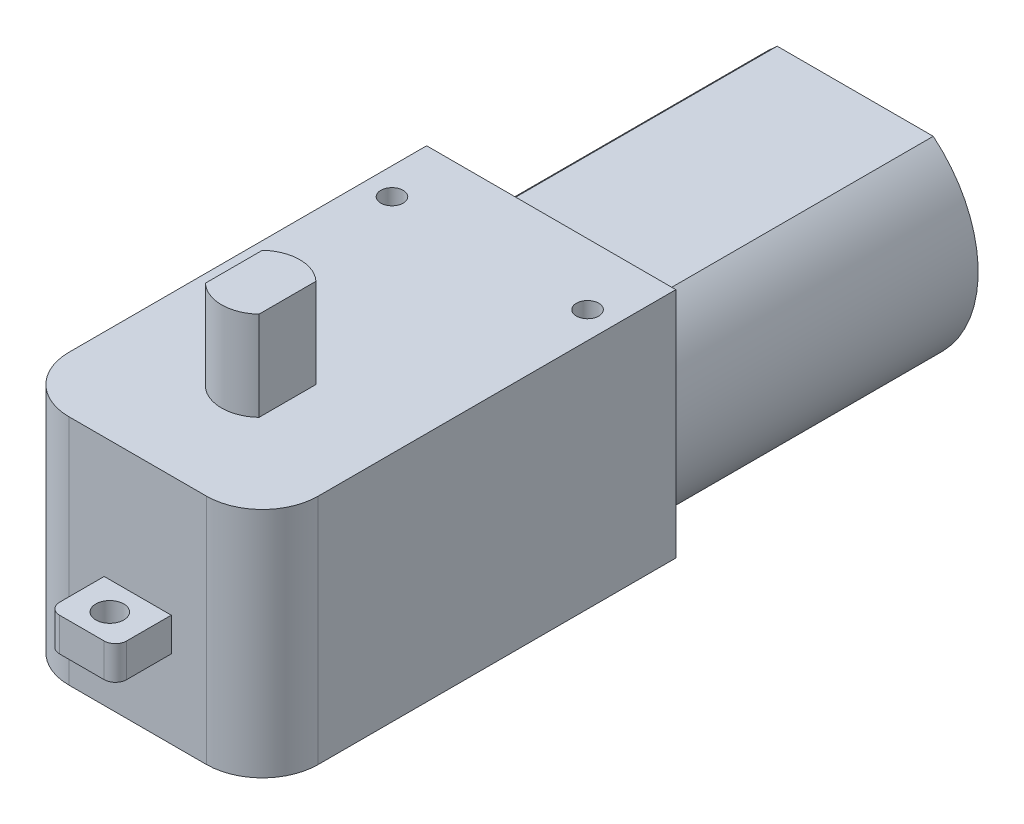
from build123d import *

# Parameters (mm, degrees)
SKETCH1_W             = 22.3
SKETCH1_H             = 37
BOSS_EXTRUDE1_DEPTH   = 20.8
FILLET1_R             = 5
BOSS_EXTRUDE2_DEPTH   = 27.2
SKETCH3_R             = 3.5
BOSS_EXTRUDE3_DEPTH   = 8
CUT_EXTRUDE1_START    = -8
CUT_EXTRUDE1_DEPTH    = 8
SKETCH5_W             = 6
SKETCH5_H             = 3
BOSS_EXTRUDE4_DEPTH   = 5
CUT_EXTRUDE2_REACH    = 69.819
SKETCH7_R             = 1.25
FILLET2_R             = 1
F_2_0MM_DOWEL_HOLE1_D = 2
SKETCH10_W            = 8
SKETCH10_H            = 23.2
BOSS_EXTRUDE5_DEPTH   = 2.5
SKETCH11_R            = 4.5
BOSS_EXTRUDE6_DEPTH   = 0.9


with BuildPart() as part:
    # Sketch1 → Boss-Extrude1 (new body)
    with BuildSketch(Plane(origin=(0, 0, 0), x_dir=(1, 0, 0), z_dir=(0, 1, 0))):
        with Locations((0, 18.5)):
            Rectangle(SKETCH1_W, SKETCH1_H)
    extrude(amount=BOSS_EXTRUDE1_DEPTH)

    # Fillet1
    fillet1_edges = [part.edges().sort_by_distance(p)[0] for p in [
        (11.15, 10.4, 0),
        (-11.15, 10.4, 0),
    ]]
    fillet(fillet1_edges, radius=FILLET1_R)

    # Sketch2 → Boss-Extrude2 (add)
    with BuildSketch(Plane(origin=(0, 0, -37), x_dir=(-1, 0, 0), z_dir=(0, 0, -1))):
        with BuildLine():
            Line((-6.982120022, 0), (6.982120022, 0))
            ThreePointArc((6.982120022, 0), (11, 8.5), (6.982120022, 17))
            Line((6.982120022, 17), (-6.982120022, 17))
            ThreePointArc((-6.982120022, 17), (-11, 8.5), (-6.982120022, 0))
        make_face()
    extrude(amount=BOSS_EXTRUDE2_DEPTH)

    # Sketch3 → Boss-Extrude3 (add)
    with BuildSketch(Plane(origin=(0, 20.8, 0), x_dir=(1, 0, 0), z_dir=(0, 1, 0))):
        with Locations(Location((0, 11, 0), (0, 0, 90))):
            Circle(SKETCH3_R)
    extrude(amount=BOSS_EXTRUDE3_DEPTH)

    # Sketch4 → Cut-Extrude1 (cut)
    with BuildSketch(Plane(origin=(0, 28.8, 0), x_dir=(1, 0, 0), z_dir=(0, 1, 0)).offset(CUT_EXTRUDE1_START)):
        with BuildLine():
            Line((-2.4, 13.547547841), (-2.4, 8.452452159))
            ThreePointArc((-2.4, 8.452452159), (-3.5, 11), (-2.4, 13.547547841))
        make_face()
        with BuildLine():
            Line((2.4, 13.547547841), (2.4, 8.452452159))
            ThreePointArc((2.4, 8.452452159), (3.5, 11), (2.4, 13.547547841))
        make_face()
    extrude(amount=CUT_EXTRUDE1_DEPTH, mode=Mode.SUBTRACT)

    # Sketch5 → Boss-Extrude4 (add)
    with BuildSketch(Plane.XY):
        with Locations((0, 8.5)):
            Rectangle(SKETCH5_W, SKETCH5_H)
    extrude(amount=BOSS_EXTRUDE4_DEPTH)

    # Sketch7 → Cut-Extrude2 (cut, up to next)
    with BuildSketch(Plane(origin=(0, 10, 0), x_dir=(1, 0, 0), z_dir=(0, 1, 0)), mode=Mode.PRIVATE) as cut_extrude2_sk1:
        with Locations(Location((0, -2.5, 0), (0, 0, 270))):
            Circle(SKETCH7_R)
    cut_extrude2_tool1 = extrude(cut_extrude2_sk1.sketch, amount=-CUT_EXTRUDE2_REACH, mode=Mode.PRIVATE) & part.part
    add(cut_extrude2_tool1.solids().sort_by_distance((0, 10, 2.5))[0], mode=Mode.SUBTRACT)

    # Fillet2
    fillet2_edges = [part.edges().sort_by_distance(p)[0] for p in [
        (3, 8.5, 5),
        (-3, 8.5, 5),
    ]]
    fillet(fillet2_edges, radius=FILLET2_R)

    # Ø2.0mm Dowel Hole1 (through all)
    with Locations(Plane(origin=(0, 20.8, 0), x_dir=(1, 0, 0), z_dir=(0, 1, 0))):
        with Locations((-8.75, 31.5), (8.75, 31.5)):
            Hole(F_2_0MM_DOWEL_HOLE1_D / 2)

    # Sketch10 → Boss-Extrude5 (add)
    with BuildSketch(Plane.XZ):
        with Locations((0, -52.6)):
            Rectangle(SKETCH10_W, SKETCH10_H)
    extrude(amount=BOSS_EXTRUDE5_DEPTH)

    # Sketch11 → Boss-Extrude6 (add)
    with BuildSketch(Plane.XZ):
        with Locations(Location((0, -11, 0), (0, 0, 270))):
            Circle(SKETCH11_R)
    extrude(amount=BOSS_EXTRUDE6_DEPTH)


solid = part.part
